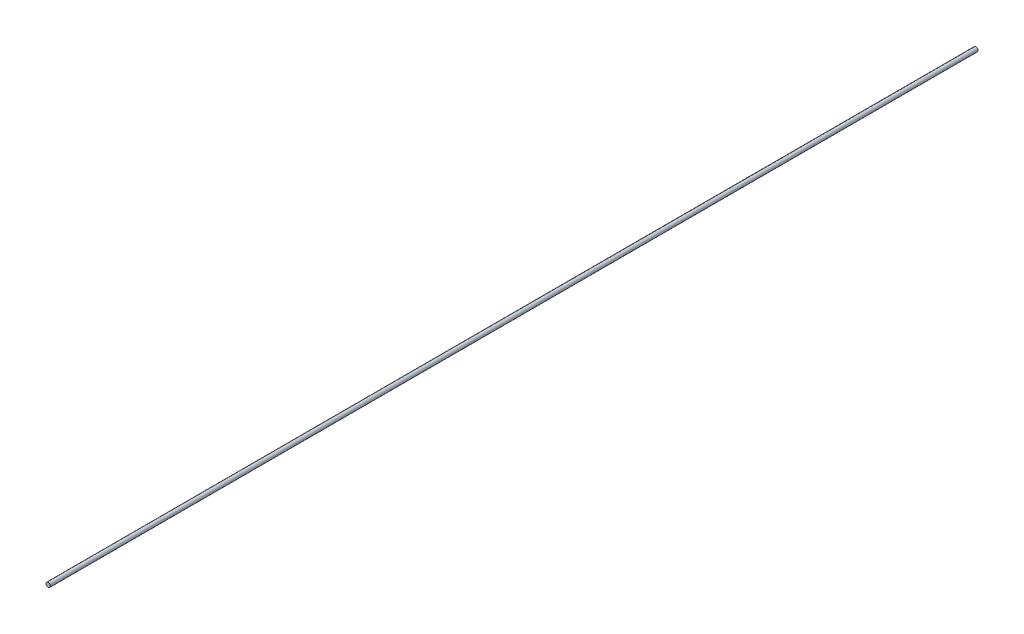
from build123d import *

# Parameters (mm, degrees)
SKETCH1_R           = 3
BOSS_EXTRUDE1_DEPTH = 1276.35


with BuildPart() as part:
    # Sketch1 → Boss-Extrude1 (new body)
    with BuildSketch(Plane.XY):
        Circle(SKETCH1_R)
    extrude(amount=BOSS_EXTRUDE1_DEPTH)


solid = part.part
